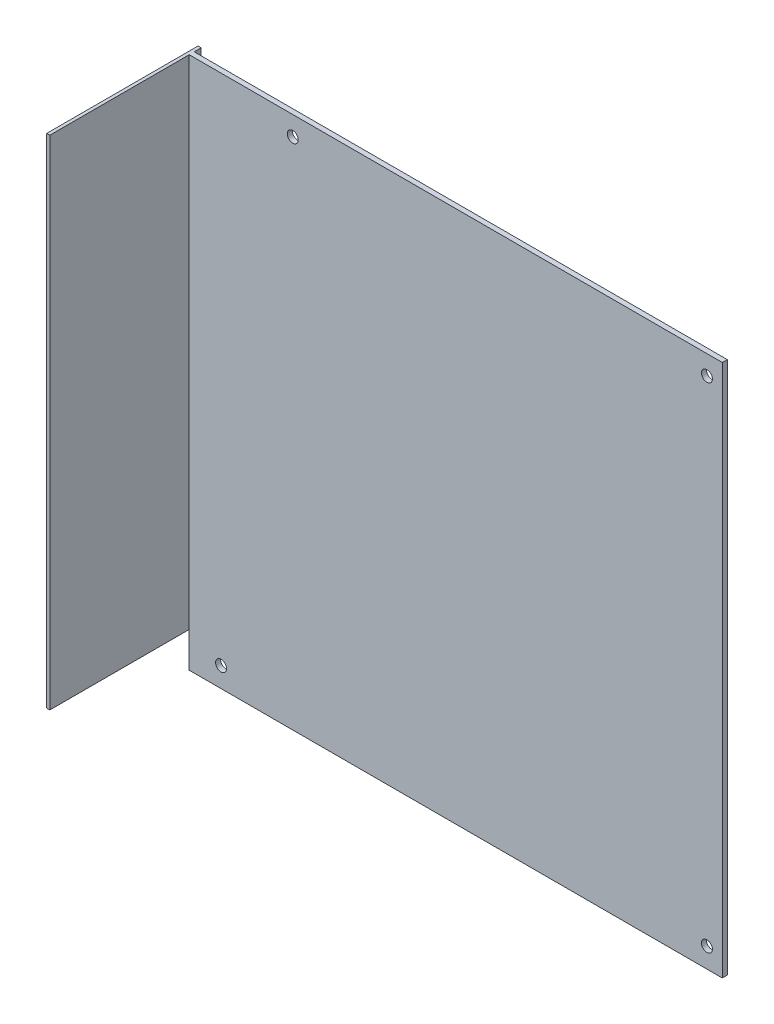
from build123d import *

# Parameters (mm, degrees)
SKETCH_1_W           = 170
SKETCH_1_H           = 170
EXTRUDE_1_DEPTH      = 1.6
SKETCH_2_R           = 1.75
CUT_EXTRUDE_2_DEPTH  = 241.421629643
EXTRUDE_2_DEPTH      = 44.45
EXTRUDE_2_DEPTH_BACK = 3.81
SKETCH_5_W           = 1
SKETCH_5_H           = 158.75


with BuildPart() as part:
    # 草图1 → 凸台-拉伸1 (new body)
    with BuildSketch(Plane.XY):
        with Locations((85, 85)):
            Rectangle(SKETCH_1_W, SKETCH_1_H)
    extrude(amount=EXTRUDE_1_DEPTH)

    # 草图2 → 切除-拉伸2 (cut, through all)
    with BuildSketch(Plane.XY.offset(1.6)):
        with Locations((10.16, 6.35)):
            Circle(SKETCH_2_R)
        with Locations((165.1, 6.35)):
            Circle(SKETCH_2_R)
        with Locations((165.1, 163.83)):
            Circle(SKETCH_2_R)
        with Locations((33.02, 163.83)):
            Circle(SKETCH_2_R)
    extrude(amount=-CUT_EXTRUDE_2_DEPTH, mode=Mode.SUBTRACT)

    # 草图5 → 凸台-拉伸2 (add, two sides: drawn at the far end of the back side and taken through both)
    with BuildSketch(Plane.XY.offset(1.6).offset(-EXTRUDE_2_DEPTH_BACK)):
        with Locations((-0.5, 90.625)):
            Rectangle(SKETCH_5_W, SKETCH_5_H)
    extrude(amount=EXTRUDE_2_DEPTH + EXTRUDE_2_DEPTH_BACK)


solid = part.part
